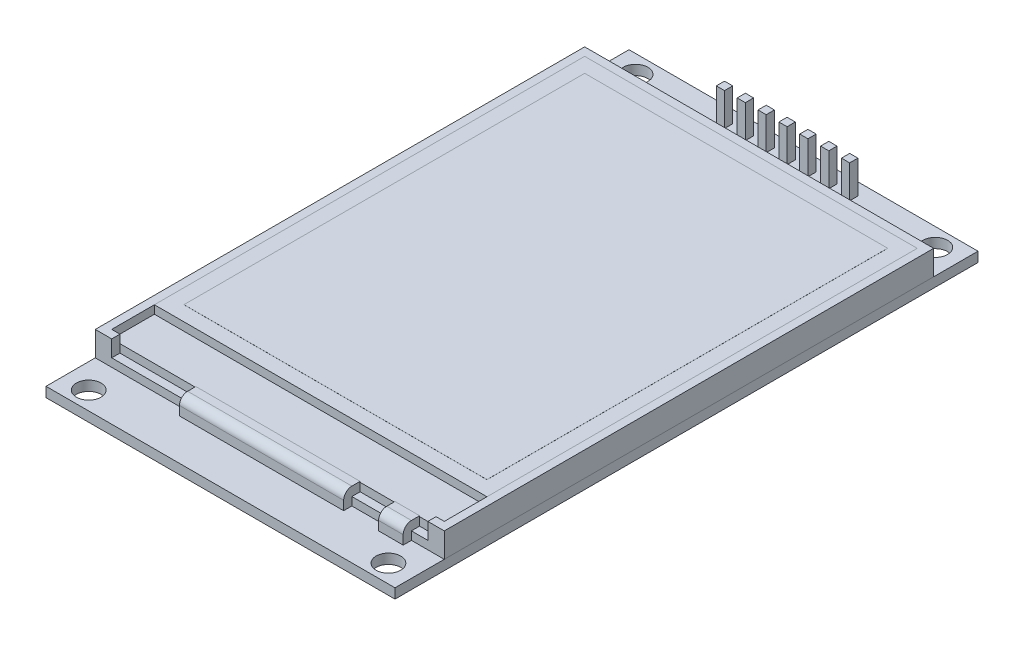
from build123d import *

# Parameters (mm, degrees)
SKETCH1_W                                  = 42.5
SKETCH1_H                                  = 71
BOSS_EXTRUDE1_DEPTH                        = 1.2
SKETCH7_R                                  = 1.5
CUT_EXTRUDE2_DEPTH                         = 42.391454432
MIRROR1_AT_THE_SECOND_PLANE_COPY_1_SKETC_R = 1.5
MIRROR1_AT_THE_SECOND_PLANE_COPY_1_DEPTH   = 42.391454432
BOSS_EXTRUDE5_START                        = -8
SKETCH8_W                                  = 1
SKETCH8_H                                  = 1
BOSS_EXTRUDE5_DEPTH                        = 12
LPATTERN1_COUNT                            = 4
LPATTERN1_PITCH                            = 2.54
LPATTERN1_COL_COUNT                        = 4
LPATTERN1_COL_PITCH                        = 2.54
SKETCH10_W                                 = 8.9
SKETCH10_H                                 = 18
PCB_COMPONENTS_DEPTH                       = 1.8
SKETCH2_W                                  = 42.5
SKETCH2_H                                  = 59.6
BOSS_EXTRUDE2_DEPTH                        = 3
SKETCH3_W                                  = 40.5
SKETCH3_H                                  = 57.6
CUT_EXTRUDE1_DEPTH                         = 43.811359474
SKETCH12_W                                 = 38.5
SKETCH12_H                                 = 2
CUT_EXTRUDE4_DEPTH                         = 1
SKETCH5_W                                  = 40.5
SKETCH5_H                                  = 57.6
BOSS_EXTRUDE3_DEPTH                        = 3
SKETCH9_W                                  = 40.5
SKETCH9_H                                  = 5.2
CUT_EXTRUDE3_DEPTH                         = 1
SKETCH6_W                                  = 36.9
SKETCH6_H                                  = 48.8
BOSS_EXTRUDE4_DEPTH                        = 0.01
SKETCH11_W                                 = 20
SKETCH11_H                                 = 2
BOSS_EXTRUDE7_DEPTH                        = 2.1
SKETCH11_W_2                               = 3
BOSS_EXTRUDE7_2_DEPTH                      = 2.1
FILLET1_R                                  = 1
FILLET2_R                                  = 1


with BuildPart() as part:
    # Sketch1 → Boss-Extrude1 (new body)
    with BuildSketch(Plane(origin=(0, 0, 0), x_dir=(1, 0, 0), z_dir=(0, 1, 0))):
        Rectangle(SKETCH1_W, SKETCH1_H)
    extrude(amount=BOSS_EXTRUDE1_DEPTH)

    # Sketch7 → Cut-Extrude2 (cut, through all)
    with BuildSketch(Plane(origin=(0, 1.2, 0), x_dir=(1, 0, 0), z_dir=(0, 1, 0))):
        with Locations(Location((-18.25, 33.3, 0), (0, 0, 270))):
            Circle(SKETCH7_R)
    cut_extrude2 = extrude(amount=-CUT_EXTRUDE2_DEPTH, mode=Mode.SUBTRACT)

    # Mirror1: Cut-Extrude2 across plane
    add(cut_extrude2.mirror(Plane.XY), mode=Mode.SUBTRACT)

    # Mirror1 at the second plane: Cut-Extrude2 across plane
    add(cut_extrude2.mirror(Plane(origin=(0, 0, 0), x_dir=(0, 0, 1), z_dir=(1, 0, 0))), mode=Mode.SUBTRACT)

    # Mirror1 at the second plane copy 1 sketc → Mirror1 at the second plane copy 1 (cut, through all)
    with BuildSketch(Plane(origin=(0, 1.2, 0), x_dir=(-1, 0, 0), z_dir=(0, 1, 0))):
        with Locations(Location((-18.25, 33.3, 0), (0, 0, 270))):
            Circle(MIRROR1_AT_THE_SECOND_PLANE_COPY_1_SKETC_R)
    extrude(amount=-MIRROR1_AT_THE_SECOND_PLANE_COPY_1_DEPTH, mode=Mode.SUBTRACT)

    # Sketch8 → Boss-Extrude5 (add)
    with BuildSketch(Plane(origin=(0, 1.2, 0), x_dir=(1, 0, 0), z_dir=(0, 1, 0)).offset(BOSS_EXTRUDE5_START)):
        with Locations((0, 33.5)):
            Rectangle(SKETCH8_W, SKETCH8_H)
    boss_extrude5 = extrude(amount=BOSS_EXTRUDE5_DEPTH)

    # LPattern1: Boss-Extrude5 ×4
    with Locations(*[(i * LPATTERN1_PITCH, 0, 0) for i in range(1, LPATTERN1_COUNT)]):
        add(boss_extrude5)

    # LPattern1 col: Boss-Extrude5 ×4
    with Locations(*[(-i * LPATTERN1_COL_PITCH, 0, 0) for i in range(1, LPATTERN1_COL_COUNT)]):
        add(boss_extrude5)


with BuildPart() as body_2:
    # Sketch10 → PCB components (new body)
    with BuildSketch(Plane.XZ):
        with Locations((-8.3, -15.5)):
            Rectangle(SKETCH10_W, SKETCH10_H)
    extrude(amount=PCB_COMPONENTS_DEPTH)


with BuildPart() as body_3:
    # Sketch2 → Boss-Extrude2 (new body)
    with BuildSketch(Plane(origin=(0, 1.2, 0), x_dir=(1, 0, 0), z_dir=(0, 1, 0))):
        with Locations((0, 0.3)):
            Rectangle(SKETCH2_W, SKETCH2_H)
    extrude(amount=BOSS_EXTRUDE2_DEPTH)

    # Sketch3 → Cut-Extrude1 (cut, through all)
    with BuildSketch(Plane(origin=(0, 4.2, 0), x_dir=(1, 0, 0), z_dir=(0, 1, 0))):
        with Locations((0, 0.3)):
            Rectangle(SKETCH3_W, SKETCH3_H)
    extrude(amount=-CUT_EXTRUDE1_DEPTH, mode=Mode.SUBTRACT)

    # Sketch12 → Cut-Extrude4 (cut)
    with BuildSketch(Plane.XY.offset(29.5)):
        with Locations((0, 3.2)):
            Rectangle(SKETCH12_W, SKETCH12_H)
    extrude(amount=-CUT_EXTRUDE4_DEPTH, mode=Mode.SUBTRACT)


with BuildPart() as body_4:
    # Sketch5 → Boss-Extrude3 (new body)
    with BuildSketch(Plane(origin=(0, 1.2, 0), x_dir=(1, 0, 0), z_dir=(0, 1, 0))):
        with Locations((0, 0.3)):
            Rectangle(SKETCH5_W, SKETCH5_H)
    extrude(amount=BOSS_EXTRUDE3_DEPTH)

    # Sketch9 → Cut-Extrude3 (cut)
    with BuildSketch(Plane(origin=(0, 4.2, 0), x_dir=(1, 0, 0), z_dir=(0, 1, 0))):
        with Locations((0, -25.9)):
            Rectangle(SKETCH9_W, SKETCH9_H)
    extrude(amount=-CUT_EXTRUDE3_DEPTH, mode=Mode.SUBTRACT)

    # Sketch6 → Boss-Extrude4 (add)
    with BuildSketch(Plane(origin=(0, 4.2, 0), x_dir=(1, 0, 0), z_dir=(0, 1, 0))):
        with Locations((0, 2.9)):
            Rectangle(SKETCH6_W, SKETCH6_H)
    extrude(amount=BOSS_EXTRUDE4_DEPTH)


with BuildPart() as body_5:
    # Sketch11 → Boss-Extrude7 (new body)
    with BuildSketch(Plane(origin=(0, 1.2, 0), x_dir=(1, 0, 0), z_dir=(0, 1, 0))):
        with Locations((0, -29.5)):
            Rectangle(SKETCH11_W, SKETCH11_H)
    extrude(amount=BOSS_EXTRUDE7_DEPTH)

    # Fillet1
    fillet1_edges = [body_5.edges().sort_by_distance(p)[0] for p in [
        (0, 3.3, 30.5),
    ]]
    fillet(fillet1_edges, radius=FILLET1_R)


with BuildPart() as body_6:
    # Sketch11 → Boss-Extrude7 2 (new body)
    with BuildSketch(Plane(origin=(0, 1.2, 0), x_dir=(1, 0, 0), z_dir=(0, 1, 0))):
        with Locations((15.75, -29.5)):
            Rectangle(SKETCH11_W_2, SKETCH11_H)
    extrude(amount=BOSS_EXTRUDE7_2_DEPTH)

    # Fillet2
    fillet2_edges = [body_6.edges().sort_by_distance(p)[0] for p in [
        (15.75, 3.3, 30.5),
    ]]
    fillet(fillet2_edges, radius=FILLET2_R)


solid = Compound([part.part, body_2.part, body_3.part, body_4.part, body_5.part, body_6.part])
